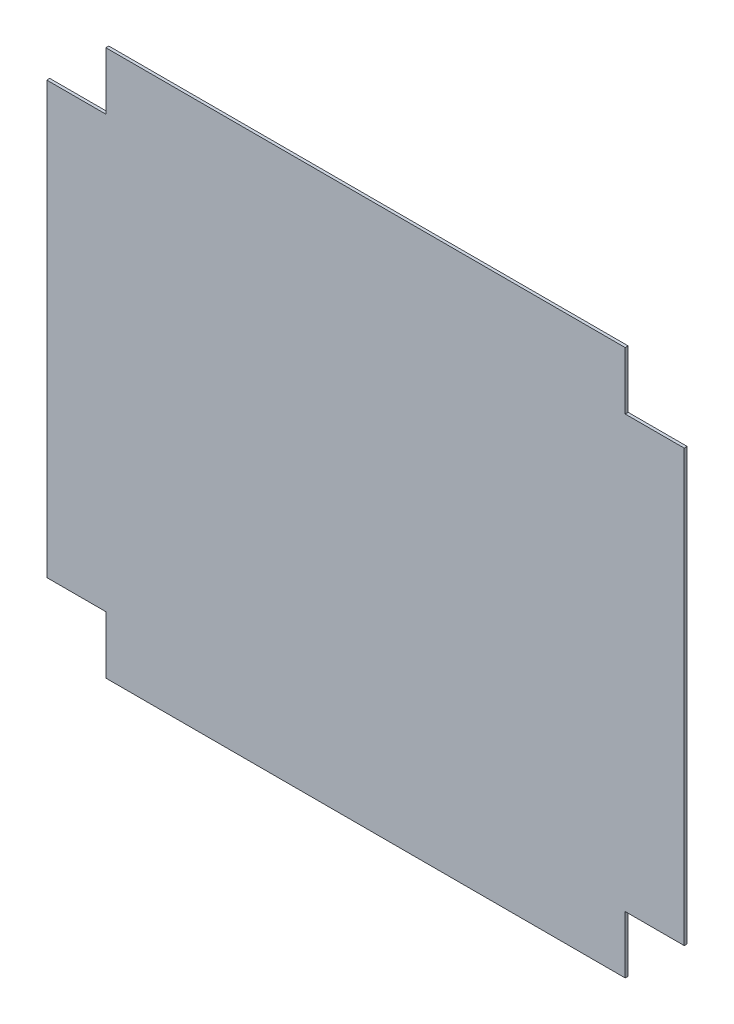
from build123d import *

# Parameters (mm, degrees)
CROQUIS1_W              = 432
CROQUIS1_H              = 370
SALIENTE_EXTRUIR1_DEPTH = 2
CROQUIS2_W              = 40
CROQUIS2_H              = 39
CORTAR_EXTRUIR1_DEPTH   = 285.402883248


with BuildPart() as part:
    # Croquis1 → Saliente-Extruir1 (new body)
    with BuildSketch(Plane.XY):
        Rectangle(CROQUIS1_W, CROQUIS1_H)
    extrude(amount=SALIENTE_EXTRUIR1_DEPTH)

    # Croquis2 → Cortar-Extruir1 (cut, through all)
    with BuildSketch(Plane.XY.offset(2)):
        with Locations((-196, 165.5)):
            Rectangle(CROQUIS2_W, CROQUIS2_H)
        with Locations((196, 165.5)):
            Rectangle(CROQUIS2_W, CROQUIS2_H)
        with Locations((196, -165.5)):
            Rectangle(CROQUIS2_W, CROQUIS2_H)
        with Locations((-196, -165.5)):
            Rectangle(CROQUIS2_W, CROQUIS2_H)
    extrude(amount=-CORTAR_EXTRUIR1_DEPTH, mode=Mode.SUBTRACT)


solid = part.part
